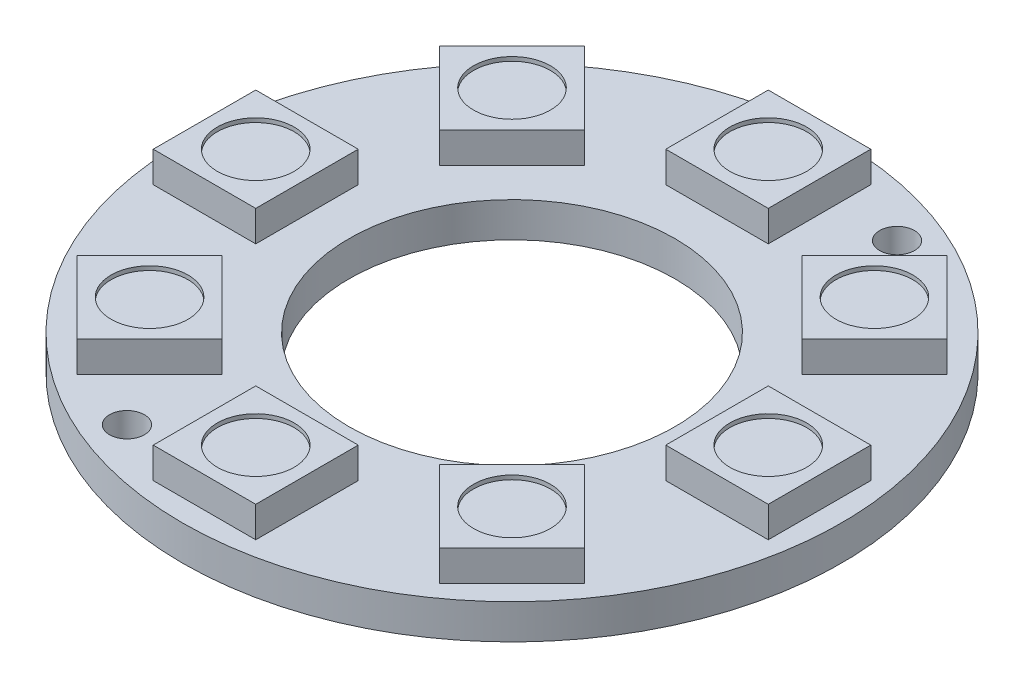
from build123d import *

# Parameters (mm, degrees)
ESQUISSE1_R                  = 16.075
ESQUISSE1_R_2                = 7.95
ESQUISSE1_R_3                = 0.85
BOSS_EXTRU_1_DEPTH           = 1.7
ESQUISSE3_W                  = 3
ESQUISSE3_H                  = 2
BOSS_EXTRU_2_DEPTH           = 0.1
ESQUISSE4_W                  = 5
ESQUISSE4_H                  = 5
BOSS_EXTRU_3_DEPTH           = 1.5
ESQUISSE5_R                  = 1.875
ENL_V_MAT_EXTRU_1_DEPTH      = 0.2
R_P_TITION_CIRCULAIRE1_COUNT = 8
ESQUISSE6_W                  = 0.108706013
ESQUISSE6_H                  = 1.211295573
BOSS_EXTRU_4_DEPTH           = 0.1


with BuildPart() as part:
    # Esquisse1 → Boss.-Extru.1 (new body)
    with BuildSketch(Plane(origin=(0, 0, 0), x_dir=(1, 0, 0), z_dir=(0, 1, 0))):
        with Locations(Location((0, 0, 0), (0, 0, 270))):
            Circle(ESQUISSE1_R)
        with Locations(Location((0, 0, 0), (0, 0, 270))):
            Circle(ESQUISSE1_R_2, mode=Mode.SUBTRACT)
        with Locations(Location((5.50107434, 13.28076828, 0), (0, 0, 270))):
            Circle(ESQUISSE1_R_3, mode=Mode.SUBTRACT)
        with Locations(Location((-5.50107434, -13.28076828, 0), (0, 0, 90))):
            Circle(ESQUISSE1_R_3, mode=Mode.SUBTRACT)
    extrude(amount=BOSS_EXTRU_1_DEPTH)

    # Esquisse3 → Boss.-Extru.2 (add)
    with BuildSketch(Plane.XZ):
        with Locations((-11.95, -4.5)):
            Rectangle(ESQUISSE3_W, ESQUISSE3_H)
        with Locations((-11.95, -1.5)):
            Rectangle(ESQUISSE3_W, ESQUISSE3_H)
        with Locations((-11.95, 1.5)):
            Rectangle(ESQUISSE3_W, ESQUISSE3_H)
        with Locations((-11.95, 4.5)):
            Rectangle(ESQUISSE3_W, ESQUISSE3_H)
    extrude(amount=BOSS_EXTRU_2_DEPTH)

    # Esquisse4 → Boss.-Extru.3 (add)
    with BuildSketch(Plane(origin=(0, 1.7, 0), x_dir=(1, 0, 0), z_dir=(0, 1, 0))):
        with Locations((0, 12.5)):
            Rectangle(ESQUISSE4_W, ESQUISSE4_H)
    boss_extru_3 = extrude(amount=BOSS_EXTRU_3_DEPTH)

    # Esquisse5 → Enlèv. mat.-Extru.1 (cut)
    with BuildSketch(Plane(origin=(0, 3.2, 0), x_dir=(1, 0, 0), z_dir=(0, 1, 0))):
        with Locations(Location((0, 12.5, 0), (0, 0, 270))):
            Circle(ESQUISSE5_R)
    enl_v_mat_extru_1 = extrude(amount=-ENL_V_MAT_EXTRU_1_DEPTH, mode=Mode.SUBTRACT)

    # Répétition circulaire1: Boss.-Extru.3, Enlèv. mat.-Extru.1 ×8 about axis
    r_p_tition_circulaire1_axis = Axis((0, 0, 0), (0, 1, 0))
    add([boss_extru_3.rotate(r_p_tition_circulaire1_axis, i * 360 / R_P_TITION_CIRCULAIRE1_COUNT) for i in range(1, R_P_TITION_CIRCULAIRE1_COUNT)])
    add([enl_v_mat_extru_1.rotate(r_p_tition_circulaire1_axis, i * 360 / R_P_TITION_CIRCULAIRE1_COUNT) for i in range(1, R_P_TITION_CIRCULAIRE1_COUNT)], mode=Mode.SUBTRACT)

    # Esquisse6 → Boss.-Extru.4 (add)
    # profile 1 of 9: a face of its own
    with BuildSketch(Plane.XZ):
        with BuildLine():
            Line((-15.094705696, -5.1), (-15.094705696, -3.888704427))
            Line((-15.094705696, -3.888704427), (-14.850117167, -3.888704427))
            add(Edge.make_bspline(
                [(-14.850117167, -3.888704427), (-14.828843706, -3.888857594), (-14.78774349, -3.889153511), (-14.72835109, -3.89102977), (-14.673398499, -3.894348881), (-14.623066449, -3.899183517), (-14.577216761, -3.905119915), (-14.53597782, -3.912560871), (-14.499136389, -3.921347322), (-14.476478433, -3.928838475), (-14.465763764, -3.93238095)],
                knots=[0, 0, 0, 0, 1.314313732, 2.53924729, 3.670748893, 4.714932338, 5.66265055, 6.526160246, 7.303039223, 8, 8, 8, 8], degree=3))
            add(Edge.make_bspline(
                [(-14.465763764, -3.93238095), (-14.451749164, -3.937721277), (-14.42403777, -3.948280831), (-14.384581677, -3.968200172), (-14.347438038, -3.990769412), (-14.312407666, -4.016018302), (-14.280290743, -4.044661756), (-14.249832579, -4.075483028), (-14.222279161, -4.10960292), (-14.197046733, -4.146313824), (-14.174296644, -4.185183278), (-14.15452167, -4.226137219), (-14.138098581, -4.268967664), (-14.124465198, -4.313555506), (-14.113720502, -4.359998785), (-14.106389764, -4.408351582), (-14.101554622, -4.458422799), (-14.101068702, -4.492399454), (-14.100822149, -4.509638997)],
                knots=[0, 0, 0, 0, 0.984719456, 1.947108742, 2.898477687, 3.838006223, 4.779231079, 5.722358779, 6.681677486, 7.655904652, 8.64651281, 9.637519902, 10.640069247, 11.656948941, 12.698408672, 13.768548281, 14.867775369, 16, 16, 16, 16], degree=3))
            add(Edge.make_bspline(
                [(-14.100822149, -4.509638997), (-14.101039825, -4.524611039), (-14.101468778, -4.554115011), (-14.105320461, -4.597597371), (-14.110918834, -4.639789762), (-14.119586241, -4.680491266), (-14.130108078, -4.720058485), (-14.143592965, -4.758069716), (-14.159040616, -4.794873655), (-14.17705427, -4.829972666), (-14.196830014, -4.863225627), (-14.218052516, -4.894572409), (-14.240699139, -4.923565711), (-14.264985834, -4.950293332), (-14.290598754, -4.974714982), (-14.317705587, -4.997034665), (-14.346376278, -5.01681566), (-14.376482415, -5.034835277), (-14.408902266, -5.050554555), (-14.444249901, -5.063854584), (-14.482676066, -5.074876202), (-14.524086439, -5.084071976), (-14.568552573, -5.091366503), (-14.616118062, -5.096255428), (-14.666709825, -5.099561549), (-14.701449528, -5.099851012), (-14.719330245, -5.1)],
                knots=[0, 0, 0, 0, 1.105936401, 2.179363191, 3.223086493, 4.248585256, 5.251745608, 6.245858792, 7.225916811, 8.198733463, 9.158002045, 10.082870192, 10.993790845, 11.873723703, 12.748670949, 13.606408763, 14.465103618, 15.319838547, 16.196477973, 17.123216899, 18.106603292, 19.147568657, 20.255746949, 21.433717677, 22.679120308, 24, 24, 24, 24], degree=3))
            Line((-14.719330245, -5.1), (-15.094705696, -5.1))
        make_face()
        with BuildLine():
            Line((-14.985999683, -4.975764557), (-14.846962751, -4.975764557))
            add(Edge.make_bspline(
                [(-14.846962751, -4.975764557), (-14.82698386, -4.975678694), (-14.788557135, -4.97551355), (-14.733301985, -4.974064424), (-14.682815394, -4.971696536), (-14.637090194, -4.96838275), (-14.596152202, -4.963998339), (-14.559915863, -4.95910993), (-14.528499957, -4.953019726), (-14.509489734, -4.947499347), (-14.500704982, -4.944948343)],
                knots=[0, 0, 0, 0, 1.375205317, 2.645023457, 3.804390687, 4.853969522, 5.800190428, 6.637939096, 7.370582563, 8, 8, 8, 8], degree=3))
            add(Edge.make_bspline(
                [(-14.500704982, -4.944948343), (-14.489648151, -4.941054354), (-14.46779858, -4.933359383), (-14.43634605, -4.919323007), (-14.407012969, -4.902696394), (-14.379288135, -4.884214697), (-14.353564835, -4.863226059), (-14.329538228, -4.840186875), (-14.307256688, -4.814979892), (-14.286950422, -4.787636396), (-14.268778115, -4.758326575), (-14.253041229, -4.727338577), (-14.239249234, -4.695011932), (-14.2284242, -4.660850227), (-14.219939737, -4.625158864), (-14.213930089, -4.587935331), (-14.210187281, -4.54918658), (-14.209750713, -4.522831514), (-14.209528162, -4.509396349)],
                knots=[0, 0, 0, 0, 0.998632004, 1.973411704, 2.929992603, 3.868527914, 4.809262121, 5.754881198, 6.702106254, 7.672490631, 8.653608572, 9.636854334, 10.631411391, 11.644891563, 12.686317036, 13.754757253, 14.855430412, 16, 16, 16, 16], degree=3))
            add(Edge.make_bspline(
                [(-14.209528162, -4.509396349), (-14.209705803, -4.495229908), (-14.210054779, -4.46739981), (-14.214441161, -4.426565065), (-14.220851183, -4.387291176), (-14.230120601, -4.349575518), (-14.241932767, -4.313344507), (-14.25667411, -4.278798527), (-14.27351687, -4.245572734), (-14.293556315, -4.214434006), (-14.315503466, -4.184984604), (-14.339860155, -4.15800562), (-14.366239417, -4.133435596), (-14.394353536, -4.110891893), (-14.424994849, -4.091281476), (-14.457441543, -4.073739604), (-14.49216962, -4.058852473), (-14.516330708, -4.050934454), (-14.528609427, -4.0469105)],
                knots=[0, 0, 0, 0, 1.122418816, 2.205001699, 3.251619955, 4.274784885, 5.280384055, 6.268708349, 7.249350384, 8.229342522, 9.199999885, 10.157847722, 11.105861043, 12.055065948, 13.010012805, 13.98527497, 14.976112212, 16, 16, 16, 16], degree=3))
            add(Edge.make_bspline(
                [(-14.528609427, -4.0469105), (-14.538767403, -4.04410153), (-14.560366045, -4.03812889), (-14.5956111, -4.031613722), (-14.635277621, -4.025867163), (-14.679541719, -4.021001894), (-14.728352936, -4.017510829), (-14.781748814, -4.014890515), (-14.83975243, -4.013123188), (-14.879961399, -4.013002506), (-14.900830463, -4.01293987)],
                knots=[0, 0, 0, 0, 0.674548936, 1.434276114, 2.292660221, 3.240891867, 4.284742987, 5.42552168, 6.663806718, 8, 8, 8, 8], degree=3))
            Line((-14.900830463, -4.01293987), (-14.985999683, -4.01293987))
            Line((-14.985999683, -4.01293987), (-14.985999683, -4.975764557))
        make_face(mode=Mode.SUBTRACT)
    # profile 2 of 9: a face of its own
    with BuildSketch(Plane.XZ):
        with Locations((-13.797998256, -4.494352214)):
            Rectangle(ESQUISSE6_W, ESQUISSE6_H)
    # profile 3 of 9: a face of its own
    with BuildSketch(Plane.XZ):
        Polygon((-14.413354701, -1.041666667), (-14.31159188, -1.041666667), (-13.958814103, -1.875697783), (-13.606036325, -1.041666667), (-13.504273504, -1.041666667), (-13.952029915, -2.1), (-13.965598291, -2.1), align=None)
    # profile 4 of 9: a face of its own
    with BuildSketch(Plane.XZ):
        with BuildLine():
            Line((-14.576175214, -1.041666667), (-14.576175214, -1.150213675))
            Line((-14.576175214, -1.150213675), (-14.936161191, -1.150213675))
            Line((-14.936161191, -1.150213675), (-14.993190772, -1.42857739))
            add(Edge.make_bspline(
                [(-14.993190772, -1.42857739), (-14.981985781, -1.425483951), (-14.960277884, -1.419490902), (-14.928237641, -1.412836776), (-14.897820474, -1.408825558), (-14.878082446, -1.408277852), (-14.868531317, -1.408012821)],
                knots=[0, 0, 0, 0, 1.100273476, 2.13160584, 3.095893838, 4, 4, 4, 4], degree=3))
            add(Edge.make_bspline(
                [(-14.868531317, -1.408012821), (-14.856713138, -1.408268615), (-14.833475647, -1.408771572), (-14.799476251, -1.413601155), (-14.767020828, -1.421202986), (-14.736177255, -1.431822763), (-14.706888469, -1.445402611), (-14.679423944, -1.462366164), (-14.653371433, -1.482182195), (-14.629198315, -1.504965092), (-14.607268346, -1.530039009), (-14.587986725, -1.556998651), (-14.571608989, -1.585582016), (-14.558437047, -1.6160622), (-14.547918927, -1.64810223), (-14.540918204, -1.682039225), (-14.536256485, -1.717553299), (-14.535735668, -1.741835872), (-14.535470085, -1.754218416)],
                knots=[0, 0, 0, 0, 1.052922333, 2.070308379, 3.05430497, 4.020497103, 4.973039431, 5.925935799, 6.892292201, 7.88610001, 8.88166317, 9.857072816, 10.836096531, 11.812156883, 12.81219415, 13.836441305, 14.89672472, 16, 16, 16, 16], degree=3))
            add(Edge.make_bspline(
                [(-14.535470085, -1.754218416), (-14.535671192, -1.762842992), (-14.536070686, -1.779975591), (-14.538102259, -1.805419194), (-14.542013773, -1.830324146), (-14.547265442, -1.854693751), (-14.55408184, -1.87848187), (-14.56233353, -1.901756594), (-14.572431853, -1.924373059), (-14.583508483, -1.946545261), (-14.595980632, -1.967771953), (-14.609823181, -1.987622956), (-14.624447984, -2.00639606), (-14.640184308, -2.023889927), (-14.657178418, -2.039989601), (-14.675224503, -2.054790629), (-14.694178564, -2.068543317), (-14.714333839, -2.080689414), (-14.735241209, -2.091866308), (-14.757202599, -2.101035568), (-14.779718096, -2.109233276), (-14.803111761, -2.115767585), (-14.827330604, -2.120887667), (-14.852414548, -2.12436523), (-14.878232036, -2.126898105), (-14.895732338, -2.127056661), (-14.904572316, -2.127136752)],
                knots=[0, 0, 0, 0, 1.056347294, 2.098418968, 3.122841568, 4.141288669, 5.149314143, 6.15115421, 7.162517403, 8.180376062, 9.185164535, 10.17417709, 11.141909838, 12.097768115, 13.052685741, 14.0056014, 14.954263652, 15.917497458, 16.885230207, 17.854509472, 18.828990115, 19.81800267, 20.826176721, 21.857883937, 22.917946725, 24, 24, 24, 24], degree=3))
            add(Edge.make_bspline(
                [(-14.904572316, -2.127136752), (-14.915117604, -2.126927856), (-14.935864212, -2.126516877), (-14.966259717, -2.122217478), (-14.995504371, -2.116059818), (-15.023362759, -2.106795993), (-15.050084546, -2.095188406), (-15.075309987, -2.08051804), (-15.099683638, -2.063893407), (-15.122214659, -2.044274824), (-15.14312615, -2.022831272), (-15.161845499, -1.999560747), (-15.178516843, -1.974847321), (-15.192873209, -1.948570974), (-15.205119039, -1.920800752), (-15.214739286, -1.891432606), (-15.222503931, -1.860619986), (-15.225788823, -1.839406901), (-15.227457265, -1.828632479)],
                knots=[0, 0, 0, 0, 1.0467383, 2.05933395, 3.04377827, 4.011590433, 4.970194871, 5.932262533, 6.905835911, 7.896367577, 8.894135286, 9.877477877, 10.858688626, 11.851381753, 12.8477658, 13.868841284, 14.917554742, 16, 16, 16, 16], degree=3))
            Line((-15.227457265, -1.828632479), (-15.132478632, -1.828632479))
            add(Edge.make_bspline(
                [(-15.132478632, -1.828632479), (-15.130141664, -1.838724882), (-15.125649881, -1.858123042), (-15.115790523, -1.885377043), (-15.103735842, -1.909664046), (-15.08940167, -1.931305325), (-15.072302018, -1.950176617), (-15.052789548, -1.966994157), (-15.030912974, -1.982166161), (-15.006603593, -1.994812569), (-14.980957733, -2.00559812), (-14.95411622, -2.01278018), (-14.926809905, -2.017830212), (-14.90834097, -2.018335721), (-14.899060163, -2.018589744)],
                knots=[0, 0, 0, 0, 1.136247022, 2.183929868, 3.172523383, 4.106158343, 5.02341133, 5.958108904, 6.928429099, 7.938127109, 8.96079061, 9.975095812, 10.982467395, 12, 12, 12, 12], degree=3))
            add(Edge.make_bspline(
                [(-14.899060163, -2.018589744), (-14.8900013, -2.018341556), (-14.872164325, -2.017852873), (-14.845914215, -2.014091552), (-14.820570798, -2.008298668), (-14.796384145, -1.99962945), (-14.772931013, -1.98909307), (-14.750804658, -1.975572083), (-14.729364979, -1.960011554), (-14.709278377, -1.942184192), (-14.690881686, -1.922538594), (-14.674626859, -1.901529953), (-14.661087173, -1.879118431), (-14.649677097, -1.855692025), (-14.641012886, -1.830993985), (-14.634831922, -1.805140058), (-14.631202426, -1.778066386), (-14.630703141, -1.75960019), (-14.630448718, -1.750190304)],
                knots=[0, 0, 0, 0, 1.027316725, 2.022795036, 3.002884548, 3.971462791, 4.93288096, 5.914575861, 6.907176829, 7.935150275, 8.956128384, 9.956726525, 10.942570165, 11.921478529, 12.907843606, 13.90538589, 14.932640048, 16, 16, 16, 16], degree=3))
            add(Edge.make_bspline(
                [(-14.630448718, -1.750190304), (-14.63064783, -1.741700732), (-14.631037562, -1.725083602), (-14.634221806, -1.700772413), (-14.63976051, -1.677769374), (-14.647448207, -1.655963403), (-14.657208915, -1.635333934), (-14.669136729, -1.615859675), (-14.683455494, -1.597797302), (-14.699811851, -1.581138363), (-14.717730354, -1.565763841), (-14.737519295, -1.552657415), (-14.758764559, -1.541631421), (-14.781210176, -1.532116098), (-14.805390038, -1.525282063), (-14.830825305, -1.520151297), (-14.857790643, -1.517183319), (-14.876227018, -1.51677151), (-14.885703793, -1.516559829)],
                knots=[0, 0, 0, 0, 1.045622112, 2.046656509, 3.013763289, 3.955457236, 4.890082067, 5.820317437, 6.762574623, 7.722996705, 8.69280354, 9.665887285, 10.63943826, 11.638615906, 12.663482002, 13.728887084, 14.832589034, 16, 16, 16, 16], degree=3))
            add(Edge.make_bspline(
                [(-14.885703793, -1.516559829), (-14.893907064, -1.516735389), (-14.910844738, -1.517097875), (-14.936826164, -1.51976684), (-14.964128662, -1.524072531), (-14.992647569, -1.529995039), (-15.022468532, -1.537745389), (-15.05352862, -1.547032868), (-15.085893138, -1.558136901), (-15.107700164, -1.566522595), (-15.118910256, -1.570833333)],
                knots=[0, 0, 0, 0, 0.817624296, 1.688186739, 2.600797293, 3.572016777, 4.590301741, 5.671205678, 6.80286297, 8, 8, 8, 8], degree=3))
            Line((-15.118910256, -1.570833333), (-15.010363248, -1.041666667))
            Line((-15.010363248, -1.041666667), (-14.576175214, -1.041666667))
        make_face()
    # profile 5 of 9: a face of its own
    with BuildSketch(Plane.XZ):
        with BuildLine():
            Line((-14.162339744, 0.9), (-14.162339744, 1.69375))
            Line((-14.162339744, 1.69375), (-14.002063301, 1.69375))
            add(Edge.make_bspline(
                [(-14.002063301, 1.69375), (-13.988123013, 1.693649631), (-13.961190448, 1.69345572), (-13.922271197, 1.692226226), (-13.886261308, 1.690051245), (-13.853279213, 1.686883156), (-13.823234367, 1.682993093), (-13.796210897, 1.678117109), (-13.772069071, 1.672359434), (-13.757221538, 1.667450555), (-13.750200321, 1.665129207)],
                knots=[0, 0, 0, 0, 1.314313732, 2.53924729, 3.670748893, 4.714932338, 5.66265055, 6.526160246, 7.303039223, 8, 8, 8, 8], degree=3))
            add(Edge.make_bspline(
                [(-13.750200321, 1.665129207), (-13.741016692, 1.661629743), (-13.72285769, 1.654710172), (-13.697002503, 1.641657225), (-13.672662644, 1.626867825), (-13.649707588, 1.610322478), (-13.628661686, 1.591552706), (-13.608702752, 1.571355831), (-13.59064727, 1.548997404), (-13.57411271, 1.524941112), (-13.559204802, 1.499470343), (-13.546246457, 1.472633631), (-13.535484569, 1.444567264), (-13.526550748, 1.415349293), (-13.519509855, 1.384915472), (-13.514706096, 1.353230363), (-13.511537675, 1.32041919), (-13.511219256, 1.298154624), (-13.511057692, 1.286857722)],
                knots=[0, 0, 0, 0, 0.984719456, 1.947108742, 2.898477687, 3.838006223, 4.779231079, 5.722358779, 6.681677486, 7.655904652, 8.64651281, 9.637519902, 10.640069247, 11.656948941, 12.698408672, 13.768548281, 14.867775369, 16, 16, 16, 16], degree=3))
            add(Edge.make_bspline(
                [(-13.511057692, 1.286857722), (-13.511200333, 1.277046691), (-13.511481422, 1.25771303), (-13.514005392, 1.22921947), (-13.51767395, 1.201571214), (-13.523353616, 1.174899921), (-13.530248472, 1.148971915), (-13.539084985, 1.124063531), (-13.549207678, 1.099946274), (-13.561011847, 1.076946239), (-13.573970696, 1.055155903), (-13.587877592, 1.034614667), (-13.602717699, 1.015615644), (-13.618632531, 0.998101298), (-13.635416423, 0.982098032), (-13.653179263, 0.967472165), (-13.671966883, 0.954509875), (-13.691695136, 0.942701798), (-13.712939544, 0.93240111), (-13.736102499, 0.923685733), (-13.761282785, 0.916463376), (-13.788418593, 0.910437476), (-13.81755681, 0.905657445), (-13.848726004, 0.902453781), (-13.881878286, 0.900287312), (-13.904642869, 0.90009763), (-13.916359926, 0.9)],
                knots=[0, 0, 0, 0, 1.105936401, 2.179363191, 3.223086493, 4.248585256, 5.251745608, 6.245858792, 7.225916811, 8.198733463, 9.158002045, 10.082870192, 10.993790845, 11.873723703, 12.748670949, 13.606408763, 14.465103618, 15.319838547, 16.196477973, 17.123216899, 18.106603292, 19.147568657, 20.255746949, 21.433717677, 22.679120308, 24, 24, 24, 24], degree=3))
            Line((-13.916359926, 0.9), (-14.162339744, 0.9))
        make_face()
        with BuildLine():
            Line((-14.091105769, 0.981410256), (-13.999996244, 0.981410256))
            add(Edge.make_bspline(
                [(-13.999996244, 0.981410256), (-13.986904274, 0.981466521), (-13.961723622, 0.981574739), (-13.925515469, 0.982524337), (-13.892432106, 0.98407599), (-13.862468835, 0.986247481), (-13.835642574, 0.989120542), (-13.811897259, 0.992323868), (-13.791310727, 0.996314719), (-13.778853516, 0.999932168), (-13.773096955, 1.001603816)],
                knots=[0, 0, 0, 0, 1.375205317, 2.645023457, 3.804390687, 4.853969522, 5.800190428, 6.637939096, 7.370582563, 8, 8, 8, 8], degree=3))
            add(Edge.make_bspline(
                [(-13.773096955, 1.001603816), (-13.765851523, 1.004155509), (-13.751533716, 1.009197947), (-13.730923184, 1.018395845), (-13.711701506, 1.0292911), (-13.693533697, 1.041401973), (-13.676677473, 1.05515562), (-13.660933075, 1.070252969), (-13.646332203, 1.086770856), (-13.633025708, 1.104688778), (-13.621117574, 1.123895214), (-13.610805349, 1.144201342), (-13.601767591, 1.165384672), (-13.594674053, 1.187770499), (-13.589114269, 1.211158697), (-13.585176206, 1.235550909), (-13.582723581, 1.260942582), (-13.582437502, 1.278212796), (-13.582291667, 1.287016727)],
                knots=[0, 0, 0, 0, 0.998632004, 1.973411704, 2.929992603, 3.868527914, 4.809262121, 5.754881198, 6.702106254, 7.672490631, 8.653608572, 9.636854334, 10.631411391, 11.644891563, 12.686317036, 13.754757253, 14.855430412, 16, 16, 16, 16], degree=3))
            add(Edge.make_bspline(
                [(-13.582291667, 1.287016727), (-13.582408073, 1.296299855), (-13.582636754, 1.314536644), (-13.585511107, 1.341295248), (-13.589711531, 1.367031038), (-13.595785688, 1.391745736), (-13.603526084, 1.415487559), (-13.61318594, 1.438125198), (-13.624222834, 1.45989773), (-13.637354484, 1.480302631), (-13.651736234, 1.499600533), (-13.667696932, 1.517279594), (-13.684983001, 1.533380087), (-13.703405905, 1.548152753), (-13.723484854, 1.561003265), (-13.744746852, 1.57249828), (-13.767503817, 1.58225367), (-13.783336339, 1.587442269), (-13.791382462, 1.590079127)],
                knots=[0, 0, 0, 0, 1.122418816, 2.205001699, 3.251619955, 4.274784885, 5.280384055, 6.268708349, 7.249350384, 8.229342522, 9.199999885, 10.157847722, 11.105861043, 12.055065948, 13.010012805, 13.98527497, 14.976112212, 16, 16, 16, 16], degree=3))
            add(Edge.make_bspline(
                [(-13.791382462, 1.590079127), (-13.798038883, 1.591919816), (-13.812192259, 1.595833628), (-13.835287995, 1.600102954), (-13.861281073, 1.603868617), (-13.890286899, 1.607056779), (-13.922272406, 1.60934444), (-13.957262196, 1.611061506), (-13.995271392, 1.612219617), (-14.021619931, 1.612298699), (-14.035295222, 1.612339744)],
                knots=[0, 0, 0, 0, 0.674548936, 1.434276114, 2.292660221, 3.240891867, 4.284742987, 5.42552168, 6.663806718, 8, 8, 8, 8], degree=3))
            Line((-14.035295222, 1.612339744), (-14.091105769, 1.612339744))
            Line((-14.091105769, 1.612339744), (-14.091105769, 0.981410256))
        make_face(mode=Mode.SUBTRACT)
    # profile 6 of 9: a face of its own
    with BuildSketch(Plane.XZ):
        Polygon((-14.976442308, 0.9), (-14.976442308, 1.69375), (-14.961495893, 1.69375), (-14.437099359, 1.069021685), (-14.437099359, 1.69375), (-14.365865385, 1.69375), (-14.365865385, 0.9), (-14.382083834, 0.9), (-14.905208333, 1.523297276), (-14.905208333, 0.9), align=None)
    # profile 7 of 9: a face of its own
    with BuildSketch(Plane.XZ):
        with BuildLine():
            Line((-15.190144231, 1.558278245), (-15.251201923, 1.500400641))
            add(Edge.make_bspline(
                [(-15.251201923, 1.500400641), (-15.262250671, 1.510794426), (-15.284084703, 1.53133415), (-15.319681044, 1.557983965), (-15.356820296, 1.580813599), (-15.395308666, 1.599388763), (-15.434193017, 1.614209836), (-15.472957221, 1.624761753), (-15.511203657, 1.631491061), (-15.53664158, 1.63229578), (-15.549176182, 1.632692308)],
                knots=[0, 0, 0, 0, 1.08915593, 2.152340314, 3.188132944, 4.216796309, 5.218260357, 6.173443236, 7.099959455, 8, 8, 8, 8], degree=3))
            add(Edge.make_bspline(
                [(-15.549176182, 1.632692308), (-15.556867551, 1.632598508), (-15.572230342, 1.632411151), (-15.595049962, 1.630019874), (-15.617630253, 1.626580699), (-15.639928589, 1.621604595), (-15.661988328, 1.615297897), (-15.683732744, 1.607409051), (-15.705202401, 1.598211701), (-15.726195066, 1.587583962), (-15.74654693, 1.575909068), (-15.76576857, 1.562971274), (-15.783982502, 1.549185245), (-15.800846384, 1.534205826), (-15.816457221, 1.518168705), (-15.831186584, 1.501372205), (-15.844516435, 1.483357432), (-15.856556752, 1.464455835), (-15.867297691, 1.444999392), (-15.876779296, 1.425175375), (-15.884738814, 1.405049537), (-15.89103653, 1.384596622), (-15.896232339, 1.363974864), (-15.899887582, 1.343041472), (-15.901948321, 1.321774032), (-15.902304778, 1.307532511), (-15.902483974, 1.300373097)],
                knots=[0, 0, 0, 0, 1.02818874, 2.053710826, 3.065248034, 4.081641283, 5.106893873, 6.131558223, 7.173050175, 8.228653731, 9.27666206, 10.308777013, 11.325269123, 12.329503258, 13.32196095, 14.316845687, 15.314881793, 16.315733098, 17.311955233, 18.285320748, 19.252783886, 20.203351036, 21.145449891, 22.095197417, 23.042428769, 24, 24, 24, 24], degree=3))
            add(Edge.make_bspline(
                [(-15.902483974, 1.300373097), (-15.902312588, 1.293054537), (-15.901970284, 1.278437401), (-15.899779462, 1.256621959), (-15.895713593, 1.23513052), (-15.890278059, 1.213892461), (-15.883478838, 1.19287141), (-15.875003251, 1.172158501), (-15.864964445, 1.151754502), (-15.853344727, 1.131843257), (-15.840602499, 1.112447857), (-15.826327908, 1.094178108), (-15.811164882, 1.076790725), (-15.794561016, 1.060671757), (-15.777048727, 1.045390052), (-15.7581048, 1.031366639), (-15.738101742, 1.018331399), (-15.717009035, 1.006448617), (-15.695055547, 0.99583311), (-15.672545533, 0.986393405), (-15.649407082, 0.978619341), (-15.625761794, 0.972283378), (-15.601637855, 0.967089917), (-15.576912814, 0.963748801), (-15.551768468, 0.961324274), (-15.534818814, 0.961147002), (-15.526279547, 0.961057692)],
                knots=[0, 0, 0, 0, 0.93586088, 1.869166235, 2.799637598, 3.729985548, 4.670839027, 5.622275134, 6.589130586, 7.576015415, 8.568469353, 9.55398029, 10.53834874, 11.515998671, 12.510579167, 13.508179873, 14.527009472, 15.561807829, 16.601455013, 17.643573243, 18.680854198, 19.719860599, 20.772568776, 21.833555941, 22.908541556, 24, 24, 24, 24], degree=3))
            add(Edge.make_bspline(
                [(-15.526279547, 0.961057692), (-15.515988386, 0.961272816), (-15.49578002, 0.961695246), (-15.466074166, 0.964983704), (-15.437543827, 0.970119674), (-15.41026917, 0.977641225), (-15.384218517, 0.987235094), (-15.359296368, 0.99880012), (-15.335698938, 1.012779885), (-15.31335529, 1.028558244), (-15.292772857, 1.046137501), (-15.274209511, 1.065106868), (-15.257961337, 1.085374269), (-15.243786164, 1.106820331), (-15.23205938, 1.12962257), (-15.222433961, 1.153669241), (-15.215055875, 1.178971159), (-15.212027157, 1.196454439), (-15.210496795, 1.205288462)],
                knots=[0, 0, 0, 0, 1.13008108, 2.219097802, 3.278683437, 4.311054135, 5.322181354, 6.324827112, 7.324222904, 8.330512327, 9.32562643, 10.293043162, 11.24128371, 12.174520618, 13.111833804, 14.052305215, 15.015860969, 16, 16, 16, 16], degree=3))
            Line((-15.210496795, 1.205288462), (-15.475080128, 1.205288462))
            Line((-15.475080128, 1.205288462), (-15.475080128, 1.286698718))
            Line((-15.475080128, 1.286698718), (-15.139262821, 1.286698718))
            add(Edge.make_bspline(
                [(-15.139262821, 1.286698718), (-15.139649683, 1.271525055), (-15.140406841, 1.241827457), (-15.145717917, 1.198518127), (-15.154294162, 1.157612404), (-15.166009982, 1.119067207), (-15.181176341, 1.08293716), (-15.199630468, 1.04918558), (-15.221667717, 1.018030511), (-15.24650312, 0.989217612), (-15.274375075, 0.963516166), (-15.304530458, 0.940926962), (-15.337019092, 0.921899048), (-15.371810245, 0.906418505), (-15.408790022, 0.894336724), (-15.448043994, 0.88577067), (-15.489518928, 0.880638517), (-15.517943496, 0.879982794), (-15.532480719, 0.879647436)],
                knots=[0, 0, 0, 0, 1.140356446, 2.231883559, 3.274166699, 4.278491846, 5.25512956, 6.21435461, 7.1637429, 8.11826594, 9.068280886, 10.0076534, 10.945064095, 11.891975133, 12.864533718, 13.863980011, 14.907571808, 16, 16, 16, 16], degree=3))
            add(Edge.make_bspline(
                [(-15.532480719, 0.879647436), (-15.541441053, 0.879776504), (-15.55911372, 0.880031069), (-15.585214699, 0.881840218), (-15.610596016, 0.884625277), (-15.635253975, 0.888831046), (-15.659279278, 0.893982405), (-15.682551934, 0.900578857), (-15.705160597, 0.908214437), (-15.727140211, 0.916899349), (-15.748291278, 0.926962207), (-15.768708006, 0.938144929), (-15.788503253, 0.950389852), (-15.807542178, 0.96390874), (-15.825923981, 0.978600476), (-15.843530137, 0.994494508), (-15.860459209, 1.011542244), (-15.871063814, 1.023647841), (-15.876407252, 1.029747596)],
                knots=[0, 0, 0, 0, 1.107784379, 2.184907829, 3.233506516, 4.263428166, 5.276301166, 6.270063455, 7.25232949, 8.225834625, 9.190232166, 10.146266622, 11.1027726, 12.066435141, 13.031522626, 14.010570082, 14.99756817, 16, 16, 16, 16], degree=3))
            add(Edge.make_bspline(
                [(-15.876407252, 1.029747596), (-15.884160133, 1.039424691), (-15.899537205, 1.05861825), (-15.919330644, 1.08937038), (-15.936203819, 1.121211516), (-15.949894379, 1.154230298), (-15.960584623, 1.188395841), (-15.968251399, 1.223664487), (-15.972743409, 1.260081654), (-15.97339055, 1.284725383), (-15.973717949, 1.297193009)],
                knots=[0, 0, 0, 0, 1.023165419, 2.029347347, 3.013907458, 3.994755782, 4.975994455, 5.96558838, 6.970761222, 8, 8, 8, 8], degree=3))
            add(Edge.make_bspline(
                [(-15.973717949, 1.297193009), (-15.973597245, 1.306528927), (-15.973357371, 1.325082109), (-15.970448727, 1.352626891), (-15.966275548, 1.379682584), (-15.960141663, 1.406227071), (-15.952409117, 1.43227808), (-15.942758594, 1.457847708), (-15.93152252, 1.482951043), (-15.918462952, 1.507415295), (-15.903929512, 1.530915831), (-15.888156515, 1.553358048), (-15.870919985, 1.574333246), (-15.852501401, 1.594107066), (-15.832681013, 1.612431091), (-15.8116445, 1.629474969), (-15.789375653, 1.645261565), (-15.765804412, 1.659542224), (-15.741282598, 1.672370045), (-15.715868991, 1.68361617), (-15.689571348, 1.6929106), (-15.662586687, 1.700796797), (-15.634710754, 1.706628623), (-15.606145838, 1.710857892), (-15.576743045, 1.713751814), (-15.556868445, 1.713984554), (-15.546791116, 1.714102564)],
                knots=[0, 0, 0, 0, 1.008945113, 2.00506715, 2.99143336, 3.967273523, 4.948097931, 5.927297278, 6.919902385, 7.919676788, 8.923139349, 9.905703106, 10.883022732, 11.856032218, 12.825136022, 13.798837087, 14.781400844, 15.773989409, 16.776158564, 17.77167057, 18.775803737, 19.789618931, 20.80898985, 21.851988756, 22.910860228, 24, 24, 24, 24], degree=3))
            add(Edge.make_bspline(
                [(-15.546791116, 1.714102564), (-15.5385728, 1.713971144), (-15.522276845, 1.713710552), (-15.498027616, 1.711904284), (-15.474153201, 1.709041368), (-15.450618198, 1.705134579), (-15.427502754, 1.699813349), (-15.404741019, 1.693445595), (-15.382299998, 1.686031557), (-15.36025002, 1.677189444), (-15.338442823, 1.667153354), (-15.316757156, 1.655856381), (-15.295267113, 1.643105353), (-15.273935426, 1.628862409), (-15.252627579, 1.613372169), (-15.231680598, 1.596191604), (-15.210588859, 1.577998229), (-15.197026662, 1.564916734), (-15.190144231, 1.558278245)],
                knots=[0, 0, 0, 0, 0.985871117, 1.954866573, 2.915460327, 3.869826059, 4.81536089, 5.759505086, 6.70452669, 7.649098992, 8.607881297, 9.583363685, 10.581137262, 11.603961102, 12.659522466, 13.73993555, 14.853081303, 16, 16, 16, 16], degree=3))
        make_face()
    # profile 8 of 9: a face of its own
    with BuildSketch(Plane.XZ):
        with BuildLine():
            add(Edge.make_bspline(
                [(-14.030048077, 4.296556991), (-14.029973687, 4.309279077), (-14.029829184, 4.333991913), (-14.028221631, 4.370002002), (-14.025551152, 4.403784067), (-14.021891426, 4.435339727), (-14.017437813, 4.464677127), (-14.011492515, 4.491717866), (-14.004731397, 4.516587099), (-13.996895396, 4.53936592), (-13.988053522, 4.560361221), (-13.978430038, 4.579961222), (-13.967643022, 4.598136267), (-13.956308973, 4.615176445), (-13.943969092, 4.630802818), (-13.930974545, 4.645236065), (-13.916818155, 4.65814261), (-13.901981151, 4.669900611), (-13.886329203, 4.680207902), (-13.870308456, 4.689286755), (-13.853808637, 4.697042796), (-13.836784699, 4.703141163), (-13.819389655, 4.708178266), (-13.801562695, 4.711622902), (-13.783274386, 4.713790272), (-13.770930114, 4.713997479), (-13.764669722, 4.714102564)],
                knots=[0, 0, 0, 0, 1.646270934, 3.197905019, 4.663502075, 6.030701355, 7.308322542, 8.50163776, 9.611534131, 10.641858119, 11.616356847, 12.558055219, 13.465016945, 14.349605745, 15.204443733, 16.039544428, 16.859896111, 17.680448484, 18.487036065, 19.28249412, 20.06191084, 20.843045899, 21.620316918, 22.403196591, 23.190181807, 24, 24, 24, 24], degree=3))
            add(Edge.make_bspline(
                [(-13.764669722, 4.714102564), (-13.758357033, 4.713991935), (-13.745803081, 4.713771927), (-13.727242853, 4.71165739), (-13.709111407, 4.708148761), (-13.691486043, 4.703177397), (-13.674221984, 4.697009806), (-13.657454263, 4.689279335), (-13.641078728, 4.680280734), (-13.62535561, 4.669707105), (-13.610112295, 4.657918267), (-13.595723203, 4.644591734), (-13.582187025, 4.629862065), (-13.569333875, 4.613886857), (-13.55752841, 4.596359703), (-13.546285863, 4.57758545), (-13.53622292, 4.557235772), (-13.526531306, 4.535650201), (-13.518165864, 4.512231479), (-13.510621555, 4.487111613), (-13.504525789, 4.459993896), (-13.499448222, 4.431020605), (-13.495514647, 4.400085336), (-13.492649744, 4.367254404), (-13.491136384, 4.332506208), (-13.490851382, 4.308748625), (-13.490705128, 4.296556991)],
                knots=[0, 0, 0, 0, 0.810914788, 1.612654377, 2.396697861, 3.181598691, 3.963628158, 4.749916497, 5.551656086, 6.361998678, 7.18212741, 8.025565596, 8.878627764, 9.750805457, 10.657531673, 11.591944965, 12.560506719, 13.57287815, 14.630710178, 15.753379473, 16.941251878, 18.199788006, 19.531962791, 20.947069417, 22.433333509, 24, 24, 24, 24], degree=3))
            add(Edge.make_bspline(
                [(-13.490705128, 4.296556991), (-13.490852898, 4.284418533), (-13.491140822, 4.260767244), (-13.492632779, 4.226175398), (-13.495571611, 4.193518698), (-13.499247805, 4.162718826), (-13.504339363, 4.133903973), (-13.51059982, 4.106974428), (-13.517550876, 4.081813898), (-13.526131266, 4.058628503), (-13.535522624, 4.037094809), (-13.545740499, 4.016986366), (-13.556687406, 3.998125439), (-13.568613782, 3.980662996), (-13.581325895, 3.964475337), (-13.595095822, 3.949848197), (-13.609535401, 3.936429134), (-13.624823574, 3.924488497), (-13.640791908, 3.914037122), (-13.657111199, 3.904690409), (-13.674071002, 3.897153709), (-13.691286975, 3.890682369), (-13.709005372, 3.885738338), (-13.727204107, 3.882319803), (-13.745790611, 3.879922259), (-13.758354894, 3.879739361), (-13.764669722, 3.879647436)],
                knots=[0, 0, 0, 0, 1.561518951, 3.042555995, 4.452378317, 5.7783523, 7.031515105, 8.214008947, 9.334062868, 10.386615937, 11.391082383, 12.354592575, 13.286541444, 14.194233754, 15.072674879, 15.931287219, 16.775624067, 17.606195743, 18.42308326, 19.229000347, 20.022332153, 20.807536673, 21.593273796, 22.3848459, 23.188221202, 24, 24, 24, 24], degree=3))
            add(Edge.make_bspline(
                [(-13.764669722, 3.879647436), (-13.77092994, 3.879753199), (-13.78327387, 3.879961742), (-13.801564688, 3.882119321), (-13.819318027, 3.885588122), (-13.836621495, 3.890445102), (-13.853563865, 3.896390252), (-13.869914273, 3.90413582), (-13.885854516, 3.913056225), (-13.901342065, 3.923215187), (-13.916085894, 3.934854211), (-13.930168971, 3.947727541), (-13.943237502, 3.962156422), (-13.955400949, 3.977913022), (-13.966961144, 3.994852382), (-13.977594984, 4.013205781), (-13.987430874, 4.032900445), (-13.996421451, 4.054063614), (-14.004392666, 4.077004106), (-14.011433843, 4.101984366), (-14.016993303, 4.129224877), (-14.021751938, 4.158506851), (-14.025590146, 4.189956117), (-14.028210502, 4.223589749), (-14.02983005, 4.259386788), (-14.029974075, 4.283940826), (-14.030048077, 4.296556991)],
                knots=[0, 0, 0, 0, 0.810891512, 1.598919785, 2.382837074, 3.152667961, 3.926044502, 4.706494248, 5.493654104, 6.291793342, 7.103789334, 7.925228297, 8.761435821, 9.622817696, 10.50288917, 11.416980706, 12.369136599, 13.353924996, 14.394355917, 15.514179734, 16.714354668, 17.994756427, 19.357759367, 20.818452758, 22.365282078, 24, 24, 24, 24], degree=3))
        make_face()
        with BuildLine():
            add(Edge.make_bspline(
                [(-13.958814103, 4.296875), (-13.958787014, 4.286273063), (-13.958734439, 4.265696785), (-13.95736098, 4.235796617), (-13.955489945, 4.207908703), (-13.953076651, 4.181997633), (-13.949492768, 4.158151112), (-13.945477121, 4.136205131), (-13.940590322, 4.116275829), (-13.934808417, 4.09822645), (-13.928222764, 4.081750679), (-13.921032327, 4.066419689), (-13.913307842, 4.052052375), (-13.904662963, 4.038777789), (-13.89524794, 4.026552641), (-13.885275433, 4.015160552), (-13.874373257, 4.005001237), (-13.859291159, 3.992816754), (-13.839380173, 3.980225807), (-13.814293034, 3.969261605), (-13.788514653, 3.962371298), (-13.771017851, 3.961495053), (-13.762284655, 3.961057692)],
                knots=[0, 0, 0, 0, 1.459021318, 2.831673884, 4.118529203, 5.306027144, 6.411944654, 7.436330062, 8.375795394, 9.233974572, 10.042671642, 10.816086306, 11.563610507, 12.285937304, 12.993564865, 13.685989202, 14.367179055, 15.041617293, 16.353048772, 17.594441528, 18.799311195, 20, 20, 20, 20], degree=3))
            add(Edge.make_bspline(
                [(-13.762284655, 3.961057692), (-13.753494969, 3.961420046), (-13.735933744, 3.962144006), (-13.710276616, 3.969128719), (-13.685368679, 3.979667347), (-13.665848793, 3.992128656), (-13.650998287, 4.003995974), (-13.640358184, 4.014113939), (-13.630592327, 4.025443216), (-13.621329928, 4.037666806), (-13.612834745, 4.051018245), (-13.605109712, 4.065433329), (-13.598060452, 4.080952089), (-13.594044294, 4.091785583), (-13.591990935, 4.097324469)],
                knots=[0, 0, 0, 0, 1.353760809, 2.704726607, 4.075137775, 5.516104923, 6.260822281, 7.007110065, 7.778089737, 8.566572457, 9.372053459, 10.217411131, 11.088608312, 12, 12, 12, 12], degree=3))
            add(Edge.make_bspline(
                [(-13.591990935, 4.097324469), (-13.589597945, 4.104406928), (-13.584739149, 4.118787357), (-13.578477193, 4.141094828), (-13.573545647, 4.16449974), (-13.569108955, 4.188862222), (-13.566080673, 4.21436194), (-13.563643222, 4.240919995), (-13.562207513, 4.268556411), (-13.562029543, 4.287333132), (-13.561939103, 4.296875)],
                knots=[0, 0, 0, 0, 0.884706709, 1.796334032, 2.740027952, 3.714592787, 4.726048262, 5.777819803, 6.87074269, 8, 8, 8, 8], degree=3))
            add(Edge.make_bspline(
                [(-13.561939103, 4.296875), (-13.562063878, 4.306415324), (-13.562307964, 4.325078239), (-13.563240958, 4.35241004), (-13.565650233, 4.378369693), (-13.568326104, 4.403069033), (-13.572271546, 4.426371333), (-13.576525548, 4.44847167), (-13.582240823, 4.469096249), (-13.588345844, 4.488567976), (-13.595333201, 4.506665624), (-13.603024805, 4.523473572), (-13.611239383, 4.539072965), (-13.620161641, 4.553421004), (-13.629685662, 4.566581955), (-13.64006282, 4.578291944), (-13.65088149, 4.588913899), (-13.666034674, 4.601038446), (-13.685872593, 4.61340092), (-13.710557231, 4.624777798), (-13.736245395, 4.631311107), (-13.75361116, 4.632232239), (-13.762284655, 4.632692308)],
                knots=[0, 0, 0, 0, 1.31362396, 2.569729283, 3.763502607, 4.902122613, 5.988968491, 7.01645872, 7.998833611, 8.933434873, 9.825090667, 10.667526885, 11.477055099, 12.250526234, 12.991942729, 13.710640831, 14.402115721, 15.076753259, 16.378508321, 17.609869233, 18.806226677, 20, 20, 20, 20], degree=3))
            add(Edge.make_bspline(
                [(-13.762284655, 4.632692308), (-13.771063665, 4.632231605), (-13.788637677, 4.631309359), (-13.814592838, 4.624802139), (-13.839472217, 4.613459913), (-13.859257678, 4.6009975), (-13.874421429, 4.589127919), (-13.885099112, 4.578834919), (-13.895110833, 4.567575858), (-13.904333686, 4.555238281), (-13.912971792, 4.541979171), (-13.920904985, 4.527694219), (-13.928052666, 4.512311034), (-13.934648623, 4.495842664), (-13.940448166, 4.477794843), (-13.945231975, 4.457890089), (-13.949651361, 4.43601391), (-13.952779931, 4.412038236), (-13.955561175, 4.386120676), (-13.957348552, 4.358163141), (-13.958739034, 4.328212826), (-13.958788579, 4.30753016), (-13.958814103, 4.296875)],
                knots=[0, 0, 0, 0, 1.207732386, 2.417664972, 3.655092373, 4.956220595, 5.625982001, 6.301752483, 6.994047911, 7.697131622, 8.419323945, 9.170223765, 9.943494443, 10.752040957, 11.610060368, 12.549350801, 13.567764191, 14.679664412, 15.874934091, 17.154273443, 18.533957287, 20, 20, 20, 20], degree=3))
        make_face(mode=Mode.SUBTRACT)
    # profile 9 of 9: a face of its own
    with BuildSketch(Plane.XZ):
        with BuildLine():
            Line((-14.772916667, 3.9), (-14.772916667, 4.69375))
            Line((-14.772916667, 4.69375), (-14.612640224, 4.69375))
            add(Edge.make_bspline(
                [(-14.612640224, 4.69375), (-14.598699936, 4.693649631), (-14.571767371, 4.69345572), (-14.53284812, 4.692226226), (-14.496838231, 4.690051245), (-14.463856136, 4.686883156), (-14.43381129, 4.682993093), (-14.40678782, 4.678117109), (-14.382645994, 4.672359434), (-14.367798461, 4.667450555), (-14.360777244, 4.665129207)],
                knots=[0, 0, 0, 0, 1.314313732, 2.53924729, 3.670748893, 4.714932338, 5.66265055, 6.526160246, 7.303039223, 8, 8, 8, 8], degree=3))
            add(Edge.make_bspline(
                [(-14.360777244, 4.665129207), (-14.351593615, 4.661629743), (-14.333434613, 4.654710172), (-14.307579426, 4.641657225), (-14.283239567, 4.626867825), (-14.260284511, 4.610322478), (-14.239238609, 4.591552706), (-14.219279675, 4.571355831), (-14.201224193, 4.548997404), (-14.184689633, 4.524941112), (-14.169781725, 4.499470343), (-14.15682338, 4.472633631), (-14.146061492, 4.444567264), (-14.137127671, 4.415349293), (-14.130086778, 4.384915472), (-14.125283019, 4.353230363), (-14.122114598, 4.32041919), (-14.121796179, 4.298154624), (-14.121634615, 4.286857722)],
                knots=[0, 0, 0, 0, 0.984719456, 1.947108742, 2.898477687, 3.838006223, 4.779231079, 5.722358779, 6.681677486, 7.655904652, 8.64651281, 9.637519902, 10.640069247, 11.656948941, 12.698408672, 13.768548281, 14.867775369, 16, 16, 16, 16], degree=3))
            add(Edge.make_bspline(
                [(-14.121634615, 4.286857722), (-14.121777256, 4.277046691), (-14.122058345, 4.25771303), (-14.124582315, 4.22921947), (-14.128250873, 4.201571214), (-14.133930539, 4.174899921), (-14.140825395, 4.148971915), (-14.149661908, 4.124063531), (-14.159784601, 4.099946274), (-14.17158877, 4.076946239), (-14.18454762, 4.055155903), (-14.198454515, 4.034614667), (-14.213294623, 4.015615644), (-14.229209454, 3.998101298), (-14.245993346, 3.982098032), (-14.263756186, 3.967472165), (-14.282543806, 3.954509875), (-14.302272059, 3.942701798), (-14.323516467, 3.93240111), (-14.346679423, 3.923685733), (-14.371859708, 3.916463376), (-14.398995516, 3.910437476), (-14.428133733, 3.905657445), (-14.459302927, 3.902453781), (-14.492455209, 3.900287312), (-14.515219792, 3.90009763), (-14.526936849, 3.9)],
                knots=[0, 0, 0, 0, 1.105936401, 2.179363191, 3.223086493, 4.248585256, 5.251745608, 6.245858792, 7.225916811, 8.198733463, 9.158002045, 10.082870192, 10.993790845, 11.873723703, 12.748670949, 13.606408763, 14.465103618, 15.319838547, 16.196477973, 17.123216899, 18.106603292, 19.147568657, 20.255746949, 21.433717677, 22.679120308, 24, 24, 24, 24], degree=3))
            Line((-14.526936849, 3.9), (-14.772916667, 3.9))
        make_face()
        with BuildLine():
            Line((-14.701682692, 3.981410256), (-14.610573167, 3.981410256))
            add(Edge.make_bspline(
                [(-14.610573167, 3.981410256), (-14.597481197, 3.981466521), (-14.572300545, 3.981574739), (-14.536092392, 3.982524337), (-14.503009029, 3.98407599), (-14.473045758, 3.986247481), (-14.446219497, 3.989120542), (-14.422474182, 3.992323868), (-14.40188765, 3.996314719), (-14.389430439, 3.999932168), (-14.383673878, 4.001603816)],
                knots=[0, 0, 0, 0, 1.375205317, 2.645023457, 3.804390687, 4.853969522, 5.800190428, 6.637939096, 7.370582563, 8, 8, 8, 8], degree=3))
            add(Edge.make_bspline(
                [(-14.383673878, 4.001603816), (-14.376428446, 4.004155509), (-14.362110639, 4.009197947), (-14.341500107, 4.018395845), (-14.322278429, 4.0292911), (-14.30411062, 4.041401973), (-14.287254396, 4.05515562), (-14.271509998, 4.070252969), (-14.256909126, 4.086770856), (-14.243602631, 4.104688778), (-14.231694498, 4.123895214), (-14.221382272, 4.144201342), (-14.212344514, 4.165384672), (-14.205250976, 4.187770499), (-14.199691192, 4.211158697), (-14.195753129, 4.235550909), (-14.193300504, 4.260942582), (-14.193014425, 4.278212796), (-14.19286859, 4.287016727)],
                knots=[0, 0, 0, 0, 0.998632004, 1.973411704, 2.929992603, 3.868527914, 4.809262121, 5.754881198, 6.702106254, 7.672490631, 8.653608572, 9.636854334, 10.631411391, 11.644891563, 12.686317036, 13.754757253, 14.855430412, 16, 16, 16, 16], degree=3))
            add(Edge.make_bspline(
                [(-14.19286859, 4.287016727), (-14.192984996, 4.296299855), (-14.193213677, 4.314536644), (-14.19608803, 4.341295248), (-14.200288454, 4.367031038), (-14.206362611, 4.391745736), (-14.214103007, 4.415487559), (-14.223762863, 4.438125198), (-14.234799757, 4.45989773), (-14.247931407, 4.480302631), (-14.262313157, 4.499600533), (-14.278273855, 4.517279594), (-14.295559925, 4.533380087), (-14.313982828, 4.548152753), (-14.334061777, 4.561003265), (-14.355323775, 4.57249828), (-14.37808074, 4.58225367), (-14.393913262, 4.587442269), (-14.401959385, 4.590079127)],
                knots=[0, 0, 0, 0, 1.122418816, 2.205001699, 3.251619955, 4.274784885, 5.280384055, 6.268708349, 7.249350384, 8.229342522, 9.199999885, 10.157847722, 11.105861043, 12.055065948, 13.010012805, 13.98527497, 14.976112212, 16, 16, 16, 16], degree=3))
            add(Edge.make_bspline(
                [(-14.401959385, 4.590079127), (-14.408615806, 4.591919816), (-14.422769182, 4.595833628), (-14.445864918, 4.600102954), (-14.471857997, 4.603868617), (-14.500863822, 4.607056779), (-14.532849329, 4.60934444), (-14.567839119, 4.611061506), (-14.605848315, 4.612219617), (-14.632196854, 4.612298699), (-14.645872145, 4.612339744)],
                knots=[0, 0, 0, 0, 0.674548936, 1.434276114, 2.292660221, 3.240891867, 4.284742987, 5.42552168, 6.663806718, 8, 8, 8, 8], degree=3))
            Line((-14.645872145, 4.612339744), (-14.701682692, 4.612339744))
            Line((-14.701682692, 4.612339744), (-14.701682692, 3.981410256))
        make_face(mode=Mode.SUBTRACT)
    extrude(amount=BOSS_EXTRU_4_DEPTH)


solid = part.part
